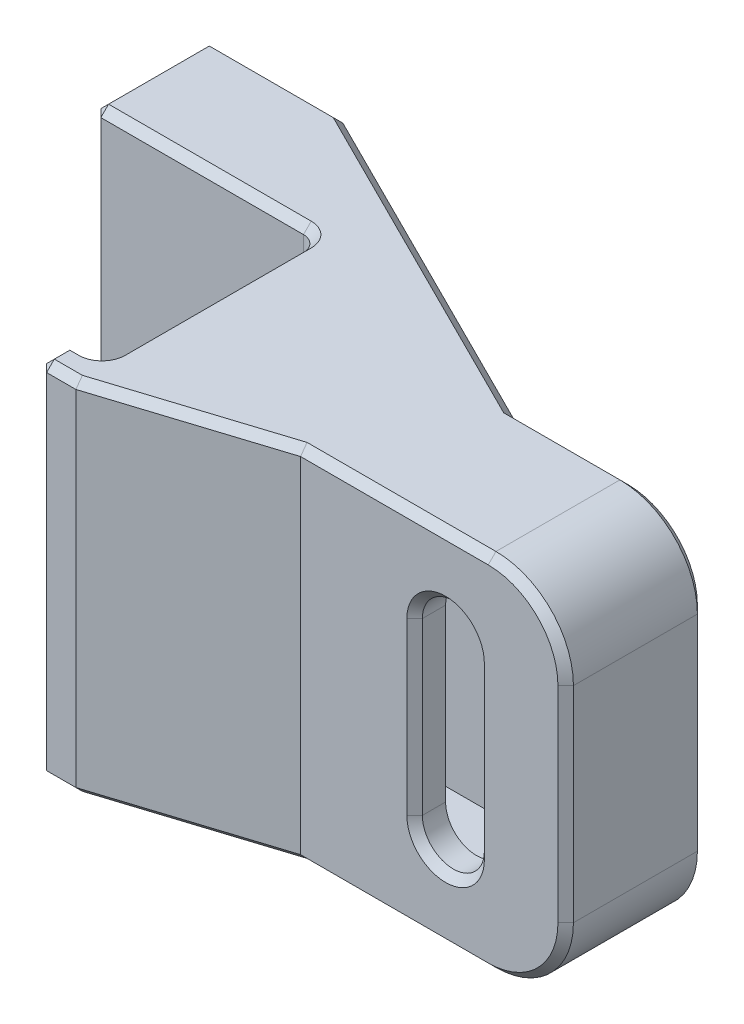
from build123d import *

# Parameters (mm, degrees)
CREATE_INTERNAL_GEOMETRY_DEPTH = 38.5
CUT_SHACKLE_HOLE_DEPTH         = 83.481816178
CAP_TOP_END_DEPTH              = 4
ROUND_CORNERS_R                = 10
UNNECESSARY_CHAMFERS_SIZE      = 1


with BuildPart() as part:
    # Sketch2 → Create internal geometry (new body)
    with BuildSketch(Plane(origin=(0, 0, 0), x_dir=(1, 0, 0), z_dir=(0, 1, 0))):
        Polygon((36.236067977, 20), (-7.763932023, 42), (-25, 42), (-25, 27), (4.236067977, 27), (26.236067977, 16), (57, 16), (57, 6), (26.155256109, 6), (4.155256109, -1), (0, -1), (0, -5), (4.776280544, -5), (26.776280544, 2), (61, 2), (61, 20), align=None)
    extrude(amount=CREATE_INTERNAL_GEOMETRY_DEPTH)

    # Sketch4 → Cut shackle hole (cut, through all)
    with BuildSketch(Plane.XY.offset(-2)):
        with BuildLine():
            Line((49.5, 30.25), (49.5, 8.25))
            ThreePointArc((49.5, 8.25), (45.5, 4.25), (41.5, 8.25))
            Line((41.5, 8.25), (41.5, 30.25))
            ThreePointArc((41.5, 30.25), (45.5, 34.25), (49.5, 30.25))
        make_face()
    extrude(amount=-CUT_SHACKLE_HOLE_DEPTH, mode=Mode.SUBTRACT)

    # Sketch3 → Cap top end (add)
    with BuildSketch(Plane(origin=(0, 38.5, 0), x_dir=(1, 0, 0), z_dir=(0, 1, 0))):
        with BuildLine():
            Line((-25, 27), (2.155256109, 27))
            ThreePointArc((2.155256109, 27), (3.569469671, 26.414213562), (4.155256109, 25))
            Line((4.155256109, 25), (4.155256109, 1))
            ThreePointArc((4.155256109, 1), (3.569469671, -0.414213562), (2.155256109, -1))
            Line((2.155256109, -1), (0, -1))
            Line((0, -1), (0, -5))
            Line((0, -5), (4.776280544, -5))
            Line((4.776280544, -5), (26.776280544, 2))
            Line((26.776280544, 2), (61, 2))
            Line((61, 2), (61, 20))
            Line((61, 20), (36.236067977, 20))
            Line((36.236067977, 20), (-7.763932023, 42))
            Line((-7.763932023, 42), (-25, 42))
            Line((-25, 42), (-25, 27))
        make_face()
    cap_top_end = extrude(amount=CAP_TOP_END_DEPTH)

    # Mirror top cap to bottom: Cap top end across plane
    add(cap_top_end.mirror(Plane.ZX.offset(19.25)))

    # Round corners
    round_corners_edges = [part.edges().sort_by_distance(p)[0] for p in [
        (61, -4, -11),
        (57, 0, -11),
        (57, 38.5, -11),
        (61, 42.5, -11),
    ]]
    fillet(round_corners_edges, radius=ROUND_CORNERS_R)

    # Unnecessary chamfers
    unnecessary_chamfers_edges = [part.edges().sort_by_distance(p)[0] for p in [
        (-25, -4, -34.5),
        (-16.381966011, -4, -42),
        (14.236067977, -4, -31),
        (38.888140272, -4, -2),
        (15.776280544, -4, 1.5),
        (2.388140272, -4, 5),
        (0, -4, 3),
        (1.077628054, -4, 1),
        (3.569469671, -4, 0.414213562),
        (4.155256109, -4, -13),
        (3.569469671, -4, -26.414213562),
        (-11.422371946, -4, -27),
        (43.618033989, 42.5, -20),
        (61, 19.25, -20),
        (43.618033989, -4, -20),
        (58.071067812, -1.071067812, -20),
        (58.071067812, 39.571067812, -20),
        (61, 19.25, -2),
        (58.071067812, -1.071067812, -2),
        (58.071067812, 39.571067812, -2),
        (0, 19.25, 1),
        (-25, 19.25, -27),
        (-25, 19.25, -42),
        (0, 19.25, 5),
        (45.5, 34.25, -20),
        (49.5, 19.25, -20),
        (45.5, 4.25, -20),
        (41.5, 19.25, -20),
        (45.5, 34.25, -2),
        (41.5, 19.25, -2),
        (45.5, 4.25, -2),
        (49.5, 19.25, -2),
        (-25, 42.5, -34.5),
        (-11.422371946, 42.5, -27),
        (3.569469671, 42.5, -26.414213562),
        (4.155256109, 42.5, -13),
        (3.569469671, 42.5, 0.414213562),
        (1.077628054, 42.5, 1),
        (0, 42.5, 3),
        (2.388140272, 42.5, 5),
        (15.776280544, 42.5, 1.5),
        (38.888140272, 42.5, -2),
        (14.236067977, 42.5, -31),
        (-16.381966011, 42.5, -42),
    ]]
    chamfer(unnecessary_chamfers_edges, length=UNNECESSARY_CHAMFERS_SIZE)


solid = part.part
